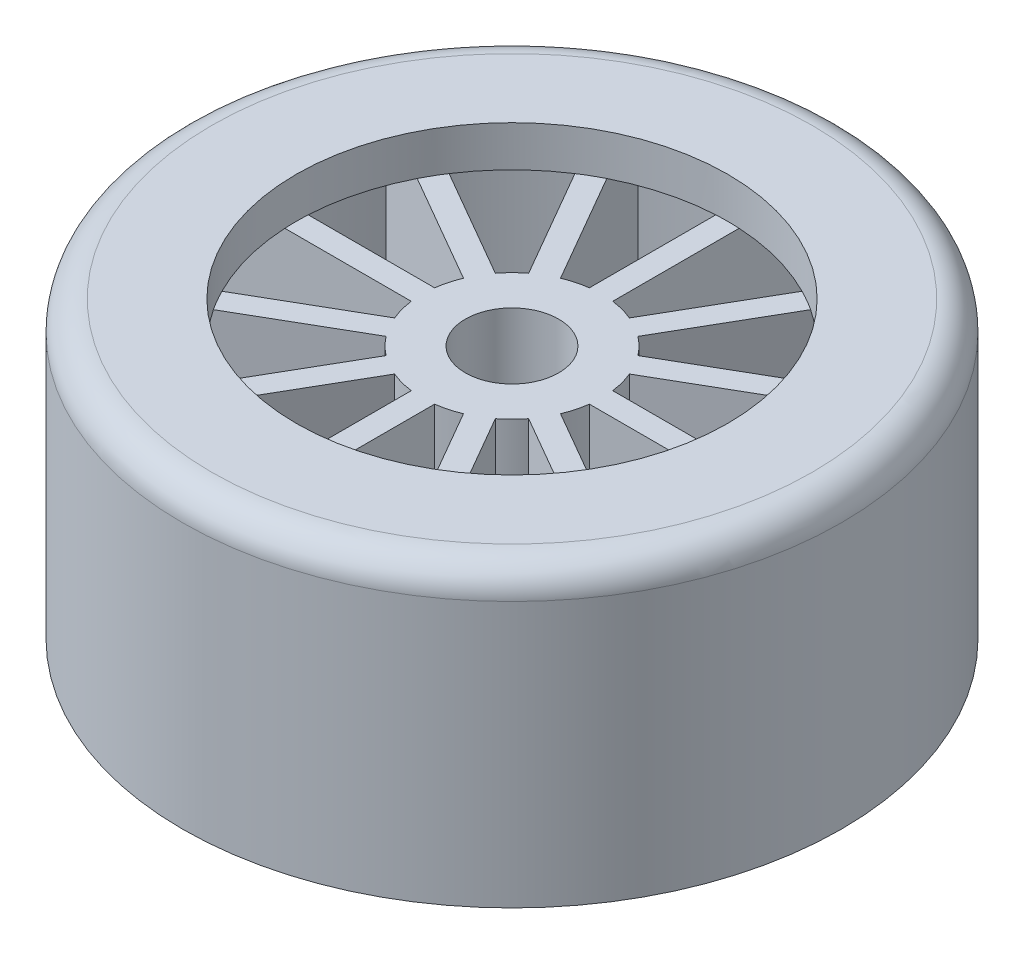
from build123d import *

# Parameters (mm, degrees)
ESBO_O1_R                     = 28.25
RESSALTO_EXTRUS_O1_DEPTH      = 12.625
ESBO_O2_R                     = 18.5
CORTE_EXTRUS_O1_DEPTH         = 3.5
ESBO_O3_R                     = 25.75
CORTE_EXTRUS_O2_DEPTH         = 21.75
RESSALTO_EXTRUS_O2_DEPTH      = 9.125
RESSALTO_EXTRUS_O2_DEPTH_BACK = 7.625
ESBO_O4_R                     = 4
FILETE1_R                     = 2.5


with BuildPart() as part:
    # Esboço1 → Ressalto-extrusão1 (new, symmetric)
    with BuildSketch(Plane(origin=(0, 0, 0), x_dir=(1, 0, 0), z_dir=(0, 1, 0))):
        with Locations(Location((0, 0, 0), (0, 0, 270))):
            Circle(ESBO_O1_R)
    extrude(amount=RESSALTO_EXTRUS_O1_DEPTH, both=True)

    # Esboço2 → Corte-extrusão1 (cut)
    with BuildSketch(Plane(origin=(0, 12.625, 0), x_dir=(1, 0, 0), z_dir=(0, 1, 0))):
        with Locations(Location((0, 0, 0), (0, 0, 270))):
            Circle(ESBO_O2_R)
    extrude(amount=-CORTE_EXTRUS_O1_DEPTH, mode=Mode.SUBTRACT)

    # Esboço3 → Corte-extrusão2 (cut)
    with BuildSketch(Plane.XZ.offset(12.625)):
        with Locations(Location((0, 0, 0), (0, 0, 270))):
            Circle(ESBO_O3_R)
    extrude(amount=-CORTE_EXTRUS_O2_DEPTH, mode=Mode.SUBTRACT)

    # Esboço4 → Ressalto-extrusão2 (add, two sides: drawn at the far end of the back side and taken through both)
    with BuildSketch(Plane(origin=(0, 0, 0), x_dir=(1, 0, 0), z_dir=(0, 1, 0)).offset(-RESSALTO_EXTRUS_O2_DEPTH_BACK)):
        with BuildLine():
            Line((4.683419803, 6.111921052), (13.741025404, 21.800154147))
            ThreePointArc((13.741025404, 21.800154147), (12.88470508, 22.316963839), (12.008974596, 22.800154147))
            Line((12.008974596, 22.800154147), (2.951368996, 7.111921052))
            ThreePointArc((2.951368996, 7.111921052), (1.992906647, 7.437628862), (1, 7.634788799))
            Line((1, 7.634788799), (1, 25.75))
            ThreePointArc((1, 25.75), (0, 25.76941016), (-1, 25.75))
            Line((-1, 25.75), (-1, 7.634788799))
            ThreePointArc((-1, 7.634788799), (-1.992906647, 7.437628862), (-2.951368996, 7.111921052))
            Line((-2.951368996, 7.111921052), (-12.008974596, 22.800154147))
            ThreePointArc((-12.008974596, 22.800154147), (-12.88470508, 22.316963839), (-13.741025404, 21.800154147))
            Line((-13.741025404, 21.800154147), (-4.683419803, 6.111921052))
            ThreePointArc((-4.683419803, 6.111921052), (-5.444722215, 5.444722215), (-6.111921052, 4.683419803))
            Line((-6.111921052, 4.683419803), (-21.800154147, 13.741025404))
            ThreePointArc((-21.800154147, 13.741025404), (-22.316963839, 12.88470508), (-22.800154147, 12.008974596))
            Line((-22.800154147, 12.008974596), (-7.111921052, 2.951368996))
            ThreePointArc((-7.111921052, 2.951368996), (-7.437628862, 1.992906647), (-7.634788799, 1))
            Line((-7.634788799, 1), (-25.75, 1))
            ThreePointArc((-25.75, 1), (-25.76941016, 0), (-25.75, -1))
            Line((-25.75, -1), (-7.634788799, -1))
            ThreePointArc((-7.634788799, -1), (-7.437628862, -1.992906647), (-7.111921052, -2.951368996))
            Line((-7.111921052, -2.951368996), (-22.800154147, -12.008974596))
            ThreePointArc((-22.800154147, -12.008974596), (-22.316963839, -12.88470508), (-21.800154147, -13.741025404))
            Line((-21.800154147, -13.741025404), (-6.111921052, -4.683419803))
            ThreePointArc((-6.111921052, -4.683419803), (-5.444722215, -5.444722215), (-4.683419803, -6.111921052))
            Line((-4.683419803, -6.111921052), (-13.741025404, -21.800154147))
            ThreePointArc((-13.741025404, -21.800154147), (-12.88470508, -22.316963839), (-12.008974596, -22.800154147))
            Line((-12.008974596, -22.800154147), (-2.951368996, -7.111921052))
            ThreePointArc((-2.951368996, -7.111921052), (-1.992906647, -7.437628862), (-1, -7.634788799))
            Line((-1, -7.634788799), (-1, -25.75))
            ThreePointArc((-1, -25.75), (0, -25.76941016), (1, -25.75))
            Line((1, -25.75), (1, -7.634788799))
            ThreePointArc((1, -7.634788799), (1.992906647, -7.437628862), (2.951368996, -7.111921052))
            Line((2.951368996, -7.111921052), (12.008974596, -22.800154147))
            ThreePointArc((12.008974596, -22.800154147), (12.88470508, -22.316963839), (13.741025404, -21.800154147))
            Line((13.741025404, -21.800154147), (4.683419803, -6.111921052))
            ThreePointArc((4.683419803, -6.111921052), (5.444722215, -5.444722215), (6.111921052, -4.683419803))
            Line((6.111921052, -4.683419803), (21.800154147, -13.741025404))
            ThreePointArc((21.800154147, -13.741025404), (22.316963839, -12.88470508), (22.800154147, -12.008974596))
            Line((22.800154147, -12.008974596), (7.111921052, -2.951368996))
            ThreePointArc((7.111921052, -2.951368996), (7.437628862, -1.992906647), (7.634788799, -1))
            Line((7.634788799, -1), (25.75, -1))
            ThreePointArc((25.75, -1), (25.76941016, 0), (25.75, 1))
            Line((25.75, 1), (7.634788799, 1))
            ThreePointArc((7.634788799, 1), (7.437628862, 1.992906647), (7.111921052, 2.951368996))
            Line((7.111921052, 2.951368996), (22.800154147, 12.008974596))
            ThreePointArc((22.800154147, 12.008974596), (22.316963839, 12.88470508), (21.800154147, 13.741025404))
            Line((21.800154147, 13.741025404), (6.111921052, 4.683419803))
            ThreePointArc((6.111921052, 4.683419803), (5.444722215, 5.444722215), (4.683419803, 6.111921052))
        make_face()
        with Locations(Location((0, 0, 0), (0, 0, 270))):
            Circle(ESBO_O4_R, mode=Mode.SUBTRACT)
    extrude(amount=RESSALTO_EXTRUS_O2_DEPTH + RESSALTO_EXTRUS_O2_DEPTH_BACK)

    # Filete1
    filete1_edges = [part.edges().sort_by_distance(p)[0] for p in [
        (0, 12.625, -28.25),
    ]]
    fillet(filete1_edges, radius=FILETE1_R)


solid = part.part
